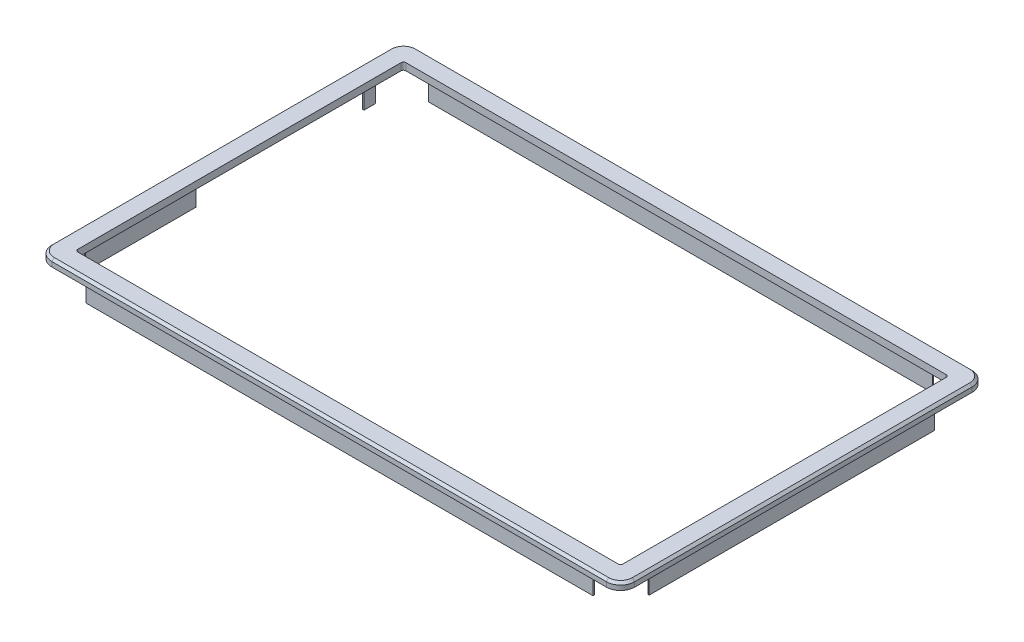
from build123d import *

# Parameters (mm, degrees)
EXTRUDE_1_DEPTH          = 10
SKETCH_2_W               = 231
SKETCH_2_H               = 139
EXTRUDE_1_2_DEPTH        = 3
FILLET_1_R               = 1
CHAMFER_1_SIZE           = 1
CUT_EXTRUDE_1_DEPTH      = 287.389594783
CUT_EXTRUDE_1_DEPTH_BACK = 2
SKETCH_3_W               = 71.087717772
SKETCH_3_H               = 10
SKETCH_4_W               = 21.591384664
SKETCH_4_H               = 17.851519678
SKETCH_4_W_2             = 20.271944057
SKETCH_4_H_2             = 16.15289462
SKETCH_4_W_3             = 20.32571751
SKETCH_4_H_3             = 19.635596567
SKETCH_4_W_4             = 22.15685921
SKETCH_4_H_4             = 28.871680817
CUT_EXTRUDE_2_DEPTH      = 10


with BuildPart() as part:
    # 草图1 → Extrude 1 (new body)
    with BuildSketch(Plane(origin=(0, 0, 0), x_dir=(1, 0, 0), z_dir=(0, 1, 0))):
        with BuildLine():
            Line((-117.5, 147), (117.5, 147))
            ThreePointArc((117.5, 147), (118.914213562, 146.414213562), (119.5, 145))
            Line((119.5, 145), (119.5, 2))
            ThreePointArc((119.5, 2), (118.914213562, 0.585786438), (117.5, 0))
            Line((117.5, 0), (-117.5, 0))
            ThreePointArc((-117.5, 0), (-118.914213562, 0.585786438), (-119.5, 2))
            Line((-119.5, 2), (-119.5, 145))
            ThreePointArc((-119.5, 145), (-118.914213562, 146.414213562), (-117.5, 147))
        make_face()
        with BuildLine():
            Line((-117.5, 146.4), (117.5, 146.4))
            ThreePointArc((117.5, 146.4), (118.489949494, 145.989949494), (118.9, 145))
            Line((118.9, 145), (118.9, 2))
            ThreePointArc((118.9, 2), (118.489949494, 1.010050506), (117.5, 0.6))
            Line((117.5, 0.6), (-117.5, 0.6))
            ThreePointArc((-117.5, 0.6), (-118.489949494, 1.010050506), (-118.9, 2))
            Line((-118.9, 2), (-118.9, 145))
            ThreePointArc((-118.9, 145), (-118.489949494, 145.989949494), (-117.5, 146.4))
        make_face(mode=Mode.SUBTRACT)
    extrude(amount=EXTRUDE_1_DEPTH)

    # 草图2 → Extrude 1 2 (add)
    with BuildSketch(Plane(origin=(0, 10, 0), x_dir=(1, 0, 0), z_dir=(0, 1, 0))):
        with BuildLine():
            Line((123.5, 2), (123.5, 145))
            ThreePointArc((123.5, 145), (121.742640687, 149.242640687), (117.5, 151))
            Line((117.5, 151), (-117.5, 151))
            ThreePointArc((-117.5, 151), (-121.742640687, 149.242640687), (-123.5, 145))
            Line((-123.5, 145), (-123.5, 2))
            ThreePointArc((-123.5, 2), (-121.742640687, -2.242640687), (-117.5, -4))
            Line((-117.5, -4), (117.5, -4))
            ThreePointArc((117.5, -4), (121.742640687, -2.242640687), (123.5, 2))
        make_face()
        with Locations((0, 73.5)):
            Rectangle(SKETCH_2_W, SKETCH_2_H, mode=Mode.SUBTRACT)
    extrude(amount=EXTRUDE_1_2_DEPTH)

    # 圆角1
    fillet_1_edges = [part.edges().sort_by_distance(p)[0] for p in [
        (-115.5, 11.5, -4),
        (115.5, 11.5, -4),
        (115.5, 11.5, -143),
        (-115.5, 11.5, -143),
    ]]
    fillet(fillet_1_edges, radius=FILLET_1_R)

    # 倒角1
    chamfer_1_edges = [part.edges().sort_by_distance(p)[0] for p in [
        (121.742640687, 13, -149.242640687),
        (0, 13, -151),
        (-121.742640687, 13, -149.242640687),
        (-123.5, 13, -73.5),
        (-121.742640687, 13, 2.242640687),
        (0, 13, 4),
        (121.742640687, 13, 2.242640687),
        (123.5, 13, -73.5),
    ]]
    chamfer(chamfer_1_edges, length=CHAMFER_1_SIZE)

    # 草图3 → 切除-拉伸1 (cut, two sides: drawn at the far end of the back side and taken through both)
    with BuildSketch(Plane.ZY.offset(119.5).offset(-CUT_EXTRUDE_1_DEPTH_BACK)):
        with Locations((-94.14273439, 5)):
            Rectangle(SKETCH_3_W, SKETCH_3_H)
    extrude(amount=CUT_EXTRUDE_1_DEPTH + CUT_EXTRUDE_1_DEPTH_BACK, mode=Mode.SUBTRACT)

    # 草图4 → 切除-拉伸2 (cut)
    with BuildSketch(Plane.XZ):
        with Locations((-117.828855159, -2.837454771)):
            Rectangle(SKETCH_4_W, SKETCH_4_H)
        with Locations((-118.488575463, -142.547638379)):
            Rectangle(SKETCH_4_W_2, SKETCH_4_H_2)
        with Locations((115.371142154, -142.781057231)):
            Rectangle(SKETCH_4_W_3, SKETCH_4_H_3)
        with Locations((118.925594218, 2.295642768)):
            Rectangle(SKETCH_4_W_4, SKETCH_4_H_4)
    extrude(amount=-CUT_EXTRUDE_2_DEPTH, mode=Mode.SUBTRACT)


solid = part.part
